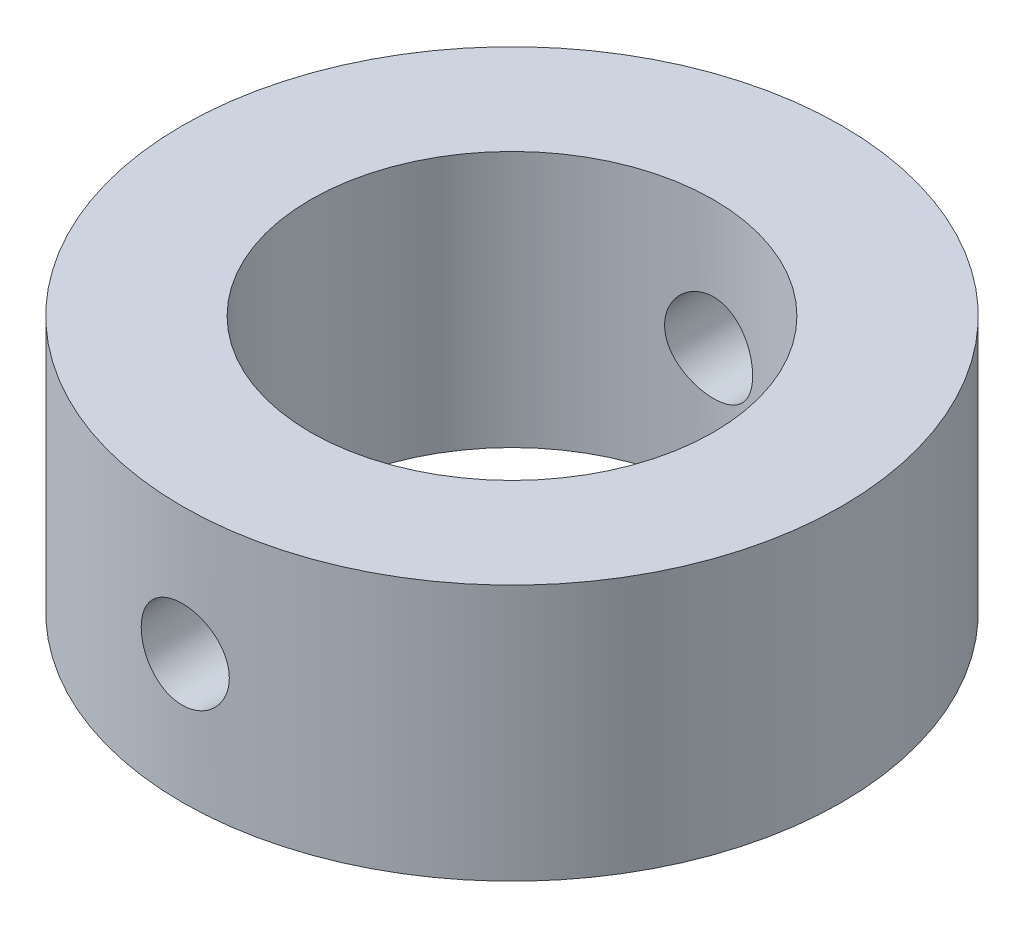
from build123d import *

# Parameters (mm, degrees)
SKETCH1_R               = 18
SKETCH1_R_2             = 11
BOSS_EXTRUDE1_DEPTH     = 14
CUT_EXTRUDE1_DEPTH      = 30.051678093
CUT_EXTRUDE1_DEPTH_BACK = 30.051678093
SKETCH3_R               = 2.404195186


with BuildPart() as part:
    # Sketch1 → Boss-Extrude1 (new body)
    with BuildSketch(Plane(origin=(0, 0, 0), x_dir=(1, 0, 0), z_dir=(0, 1, 0))):
        with Locations(Location((0, 0, 0), (0, 0, 270))):
            Circle(SKETCH1_R)
        with Locations(Location((0, 0, 0), (0, 0, 270))):
            Circle(SKETCH1_R_2, mode=Mode.SUBTRACT)
    extrude(amount=BOSS_EXTRUDE1_DEPTH)

    # Sketch3 → Cut-Extrude1 (cut, two sides: drawn at the far end of the back side and taken through both)
    with BuildSketch(Plane.XY.offset(-CUT_EXTRUDE1_DEPTH_BACK)):
        with Locations((0, 7)):
            Circle(SKETCH3_R)
    extrude(amount=CUT_EXTRUDE1_DEPTH + CUT_EXTRUDE1_DEPTH_BACK, mode=Mode.SUBTRACT)


solid = part.part
